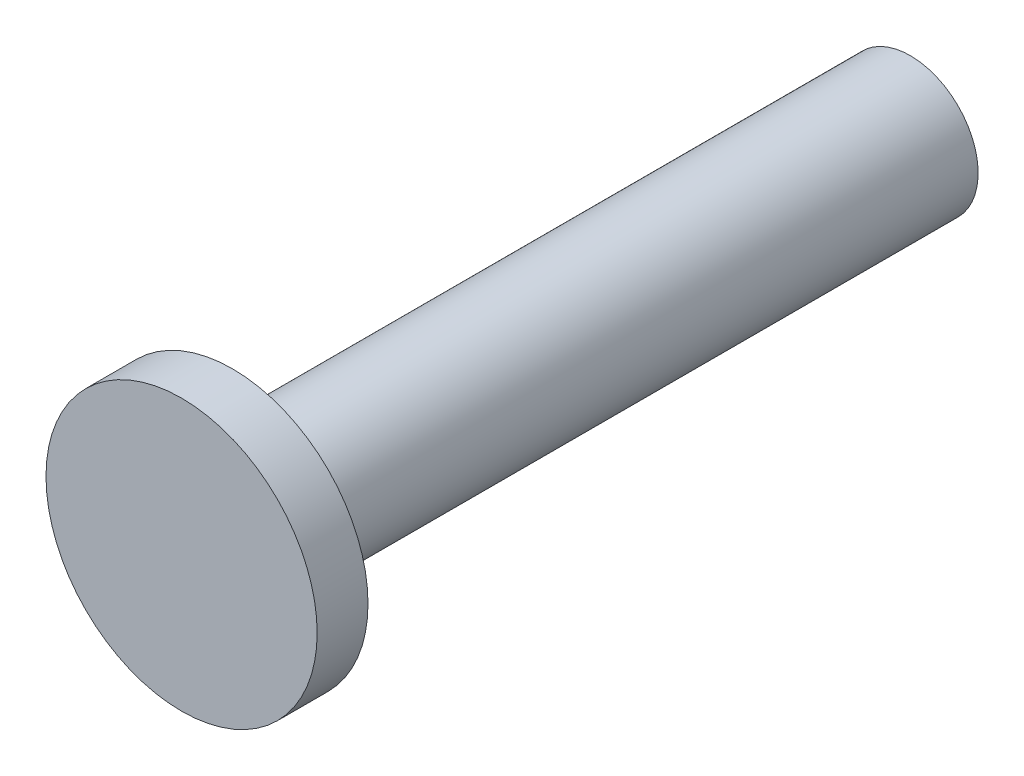
from build123d import *

# Parameters (mm, degrees)
ESQUISSE1_R        = 4
BOSS_EXTRU_1_DEPTH = 1.5
ESQUISSE2_R        = 2
BOSS_EXTRU_2_DEPTH = 20


with BuildPart() as part:
    # Esquisse1 → Boss.-Extru.1 (new body)
    with BuildSketch(Plane.XY):
        Circle(ESQUISSE1_R)
    extrude(amount=BOSS_EXTRU_1_DEPTH)

    # Esquisse2 → Boss.-Extru.2 (add)
    with BuildSketch(Plane(origin=(0, 0, 0), x_dir=(-1, 0, 0), z_dir=(0, 0, -1))):
        Circle(ESQUISSE2_R)
    extrude(amount=BOSS_EXTRU_2_DEPTH)


solid = part.part
